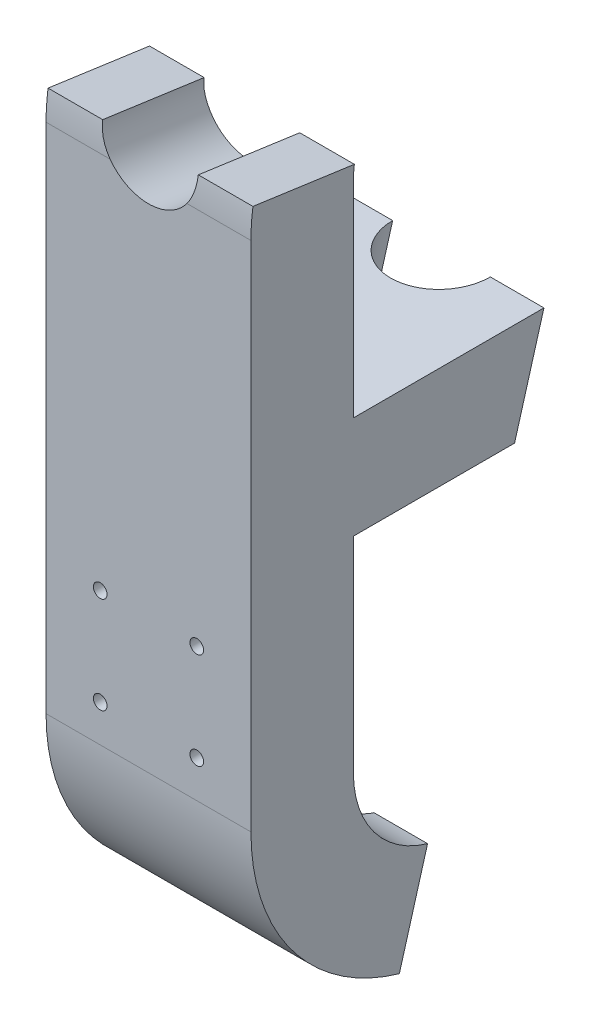
from build123d import *

# Parameters (mm, degrees)
SKETCH_1_W          = 60
SKETCH_1_H          = 150
EXTRUDE_1_DEPTH     = 30
SKETCH_2_R          = 5
CUT_EXTRUDE_1_DEPTH = 18
SKETCH_6_R          = 2
CUT_EXTRUDE_2_DEPTH = 83.758685345
EXTRUDE_2_DEPTH     = 60
SKETCH_8_W          = 60
SKETCH_8_H          = 30
EXTRUDE_3_DEPTH     = 60
SKETCH_9_W          = 139.095899212
SKETCH_9_H          = 109.690247042
CUT_EXTRUDE_3_DEPTH = 138.516765531
CUT_EXTRUDE_4_DEPTH = 221.495173564
EXTRUDE_4_DEPTH     = 30
CUT_EXTRUDE_5_DEPTH = 240.854663136


with BuildPart() as part:
    # 草图1 → 凸台-拉伸1 (new body)
    with BuildSketch(Plane.XY):
        Rectangle(SKETCH_1_W, SKETCH_1_H)
    extrude(amount=-EXTRUDE_1_DEPTH)

    # 草图2 → 切除-拉伸1 (cut)
    with BuildSketch(Plane(origin=(0, 0, -30), x_dir=(-1, 0, 0), z_dir=(0, 0, -1))):
        with Locations((-14.142135624, -35.857864376)):
            Circle(SKETCH_2_R)
        with Locations((14.142135624, -35.857864376)):
            Circle(SKETCH_2_R)
        with Locations((14.142135624, -64.142135624)):
            Circle(SKETCH_2_R)
        with Locations((-14.142135624, -64.142135624)):
            Circle(SKETCH_2_R)
    extrude(amount=-CUT_EXTRUDE_1_DEPTH, mode=Mode.SUBTRACT)

    # 草图6 → 切除-拉伸2 (cut, through all)
    with BuildSketch(Plane(origin=(0, 0, -12), x_dir=(-1, 0, 0), z_dir=(0, 0, -1))):
        with Locations((14.142135624, -64.142135624)):
            Circle(SKETCH_6_R)
        with Locations((-14.142135624, -64.142135624)):
            Circle(SKETCH_6_R)
        with Locations((-14.142135624, -35.857864376)):
            Circle(SKETCH_6_R)
        with Locations((14.142135624, -35.857864376)):
            Circle(SKETCH_6_R)
    extrude(amount=-CUT_EXTRUDE_2_DEPTH, mode=Mode.SUBTRACT)

    # 草图7 → 凸台-拉伸2 (add)
    with BuildSketch(Plane(origin=(30, 0, 0), x_dir=(0, 0, -1), z_dir=(1, 0, 0))):
        with BuildLine():
            Line((43.461758651, -132.675701756), (51.730879325, -103.837850878))
            ThreePointArc((51.730879325, -103.837850878), (36.040934699, -93.054450695), (30, -75))
            Line((30, -75), (0, -75))
            ThreePointArc((0, -75), (12.081869397, -111.108901389), (43.461758651, -132.675701756))
        make_face()
    extrude(amount=-EXTRUDE_2_DEPTH)

    # 草图8 → 凸台-拉伸3 (add)
    with BuildSketch(Plane(origin=(0, 0, -30), x_dir=(-1, 0, 0), z_dir=(0, 0, -1))):
        Rectangle(SKETCH_8_W, SKETCH_8_H)
    extrude(amount=EXTRUDE_3_DEPTH)

    # 草图9 → 切除-拉伸3 (cut, through all)
    with BuildSketch(Plane(origin=(0, -21.595774321, -75.313415293), x_dir=(-1, 0, 0), z_dir=(0, -0.27563735581699267, -0.9612616959383208))):
        Rectangle(SKETCH_9_W, SKETCH_9_H)
    extrude(amount=CUT_EXTRUDE_3_DEPTH, mode=Mode.SUBTRACT)

    # 草图10 → 切除-拉伸4 (cut, through all)
    with BuildSketch(Plane(origin=(30, -132.675701756, -43.461758651), x_dir=(-1, 0, 0), z_dir=(0, -0.9612616959383208, 0.27563735581699267))):
        with BuildLine():
            ThreePointArc((15.7, 0), (30, -14.3), (44.3, 0))
            Line((44.3, 0), (15.7, 0))
        make_face()
        with BuildLine():
            Line((15.7, 0), (44.3, 0))
            ThreePointArc((44.3, 0), (30, 14.3), (15.7, 0))
        make_face()
    extrude(amount=-CUT_EXTRUDE_4_DEPTH, mode=Mode.SUBTRACT)

    # 草图11 → 凸台-拉伸4 (add, symmetric)
    with BuildSketch(Plane(origin=(0, 0, 0), x_dir=(0, 0, -1), z_dir=(1, 0, 0))):
        with BuildLine():
            ThreePointArc((30, 75), (30.073078492, 77.092694212), (30.291957938, 79.175193029))
            Line((30.291957938, 79.175193029), (0.583915876, 83.350386058))
            ThreePointArc((0.583915876, 83.350386058), (0.146156984, 79.185388425), (0, 75))
            Line((0, 75), (30, 75))
        make_face()
    extrude(amount=EXTRUDE_4_DEPTH, both=True)

    # 草图12 → 切除-拉伸5 (cut, through all)
    with BuildSketch(Plane(origin=(30, 83.350386058, -0.583915876), x_dir=(1, 0, 0), z_dir=(0, 0.1391731009600656, 0.9902680687415703))):
        with BuildLine():
            ThreePointArc((-16, 0), (-30, 14), (-44, 0))
            Line((-44, 0), (-16, 0))
        make_face()
        with BuildLine():
            Line((-16, 0), (-44, 0))
            ThreePointArc((-44, 0), (-30, -14), (-16, 0))
        make_face()
    extrude(amount=-CUT_EXTRUDE_5_DEPTH, mode=Mode.SUBTRACT)


solid = part.part
